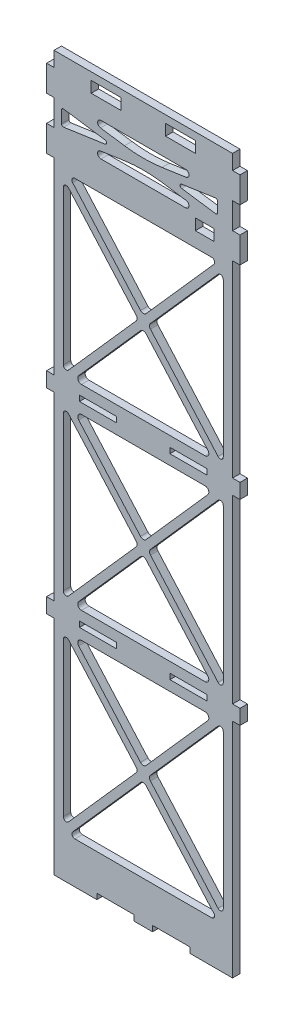
from build123d import *

# Parameters (mm, degrees)
SKETCH_1_W      = 5
SKETCH_1_H      = 3
SKETCH_1_W_2    = 8
EXTRUDE_1_DEPTH = 2


with BuildPart() as part:
    # 草图1 → 凸台-拉伸1 (new body)
    with BuildSketch(Plane.XY):
        Polygon((2263.240360422, 1874.892720575), (2311.240360422, 1874.892720575), (2311.240360422, 1870.892720575), (2313.240360422, 1870.892720575), (2313.240360422, 1863.892720575), (2311.240360422, 1863.892720575), (2311.240360422, 1856.892720575), (2313.240360422, 1856.892720575), (2313.240360422, 1849.892720575), (2311.240360422, 1849.892720575), (2311.240360422, 1799.292720575), (2313.240360422, 1799.292720575), (2313.240360422, 1795.292720575), (2311.240360422, 1795.292720575), (2311.240360422, 1746.692720575), (2313.240360422, 1746.692720575), (2313.240360422, 1742.692720575), (2311.240360422, 1742.692720575), (2311.240360422, 1682.892720575), (2299.740360422, 1682.892720575), (2299.740360422, 1684.392720575), (2289.740360422, 1684.392720575), (2289.740360422, 1683.642720575), (2289.740360422, 1682.892720575), (2284.740360422, 1682.892720575), (2284.740360422, 1683.642720575), (2284.740360422, 1684.392720575), (2274.740360422, 1684.392720575), (2274.740360422, 1682.892720575), (2263.240360422, 1682.892720575), (2263.240360422, 1742.692720575), (2261.240360422, 1742.692720575), (2261.240360422, 1746.692720575), (2263.240360422, 1746.692720575), (2263.240360422, 1795.292720575), (2261.240360422, 1795.292720575), (2261.240360422, 1799.292720575), (2263.240360422, 1799.292720575), (2263.240360422, 1849.892720575), (2261.240360422, 1849.892720575), (2261.240360422, 1856.892720575), (2263.240360422, 1856.892720575), (2263.240360422, 1863.892720575), (2261.240360422, 1863.892720575), (2261.240360422, 1870.892720575), (2263.240360422, 1870.892720575), align=None)
        with Locations((2303.740360422, 1853.392720575)):
            Rectangle(SKETCH_1_W, SKETCH_1_H, mode=Mode.SUBTRACT)
        with BuildLine():
            Line((2268.851583431, 1847.892720575), (2305.629137413, 1847.892720575))
            ThreePointArc((2305.629137413, 1847.892720575), (2306.358551508, 1847.421285756), (2306.228287599, 1846.562608271))
            Line((2306.228287599, 1846.562608271), (2290.985049082, 1829.334203808))
            Line((2290.985049082, 1829.334203808), (2290.139510608, 1828.378548695))
            Line((2290.139510608, 1828.378548695), (2287.989298154, 1825.948308573))
            ThreePointArc((2287.989298154, 1825.948308573), (2287.240360422, 1825.610948953), (2286.49142269, 1825.948308573))
            Line((2286.49142269, 1825.948308573), (2284.341210236, 1828.378548695))
            Line((2284.341210236, 1828.378548695), (2283.495671762, 1829.334203808))
            Line((2283.495671762, 1829.334203808), (2268.252433245, 1846.562608271))
            ThreePointArc((2268.252433245, 1846.562608271), (2268.122169336, 1847.421285756), (2268.851583431, 1847.892720575))
        make_face(mode=Mode.SUBTRACT)
        with BuildLine():
            Line((2305.341210236, 1842.541776176), (2289.161871666, 1824.255360955))
            ThreePointArc((2289.161871666, 1824.255360955), (2288.910809399, 1823.592720575), (2289.161871666, 1822.930080195))
            Line((2289.161871666, 1822.930080195), (2305.341210236, 1804.643664974))
            Line((2305.341210236, 1804.643664974), (2307.341210236, 1802.383199858))
            ThreePointArc((2307.341210236, 1802.383199858), (2308.223803407, 1802.165207841), (2308.740360422, 1802.913312162))
            Line((2308.740360422, 1802.913312162), (2308.740360422, 1823.592720575))
            Line((2308.740360422, 1823.592720575), (2308.740360422, 1844.272128988))
            ThreePointArc((2308.740360422, 1844.272128988), (2308.223803407, 1845.020233309), (2307.341210236, 1844.802241293))
            Line((2307.341210236, 1844.802241293), (2305.341210236, 1842.541776176))
        make_face(mode=Mode.SUBTRACT)
        with BuildLine():
            Line((2286.49142269, 1821.237132577), (2269.873805823, 1802.455360955))
            ThreePointArc((2269.873805823, 1802.455360955), (2269.710975936, 1801.382014098), (2270.622743555, 1800.792720575))
            Line((2270.622743555, 1800.792720575), (2287.240360422, 1800.792720575))
            Line((2287.240360422, 1800.792720575), (2303.857977289, 1800.792720575))
            ThreePointArc((2303.857977289, 1800.792720575), (2304.769744908, 1801.382014098), (2304.606915021, 1802.455360955))
            Line((2304.606915021, 1802.455360955), (2287.989298154, 1821.237132577))
            ThreePointArc((2287.989298154, 1821.237132577), (2287.240360422, 1821.574492197), (2286.49142269, 1821.237132577))
        make_face(mode=Mode.SUBTRACT)
        with BuildLine():
            Line((2285.318849178, 1822.930080195), (2269.139510608, 1804.643664974))
            Line((2269.139510608, 1804.643664974), (2267.139510608, 1802.383199858))
            ThreePointArc((2267.139510608, 1802.383199858), (2266.256917437, 1802.165207841), (2265.740360422, 1802.913312162))
            Line((2265.740360422, 1802.913312162), (2265.740360422, 1823.592720575))
            Line((2265.740360422, 1823.592720575), (2265.740360422, 1844.272128988))
            ThreePointArc((2265.740360422, 1844.272128988), (2266.256917437, 1845.020233309), (2267.139510608, 1844.802241293))
            Line((2267.139510608, 1844.802241293), (2269.139510608, 1842.541776176))
            Line((2269.139510608, 1842.541776176), (2285.318849178, 1824.255360955))
            ThreePointArc((2285.318849178, 1824.255360955), (2285.569911446, 1823.592720575), (2285.318849178, 1822.930080195))
        make_face(mode=Mode.SUBTRACT)
        Polygon((2294.398544686, 1796.542720575), (2294.398544686, 1797.292720575), (2294.398544686, 1798.042720575), (2304.398544686, 1798.042720575), (2304.398544686, 1796.542720575), align=None, mode=Mode.SUBTRACT)
        Polygon((2280.082176158, 1796.542720575), (2280.082176158, 1797.292720575), (2280.082176158, 1798.042720575), (2270.082176158, 1798.042720575), (2270.082176158, 1796.542720575), align=None, mode=Mode.SUBTRACT)
        with BuildLine():
            Line((2305.341210236, 1789.941776176), (2289.161871666, 1771.655360955))
            ThreePointArc((2289.161871666, 1771.655360955), (2288.910809398, 1770.992720575), (2289.161871666, 1770.330080195))
            Line((2289.161871666, 1770.330080195), (2305.341210236, 1752.043664974))
            Line((2305.341210236, 1752.043664974), (2307.341210236, 1749.783199858))
            ThreePointArc((2307.341210236, 1749.783199858), (2308.223803407, 1749.565207841), (2308.740360422, 1750.313312162))
            Line((2308.740360422, 1750.313312162), (2308.740360422, 1770.992720575))
            Line((2308.740360422, 1770.992720575), (2308.740360422, 1791.672128988))
            ThreePointArc((2308.740360422, 1791.672128988), (2308.223803407, 1792.420233309), (2307.341210236, 1792.202241292))
            Line((2307.341210236, 1792.202241292), (2305.341210236, 1789.941776176))
        make_face(mode=Mode.SUBTRACT)
        with BuildLine():
            Line((2286.49142269, 1768.637132577), (2269.873805823, 1749.855360955))
            ThreePointArc((2269.873805823, 1749.855360955), (2269.710975936, 1748.782014098), (2270.622743555, 1748.192720575))
            Line((2270.622743555, 1748.192720575), (2287.240360422, 1748.192720575))
            Line((2287.240360422, 1748.192720575), (2303.857977289, 1748.192720575))
            ThreePointArc((2303.857977289, 1748.192720575), (2304.769744908, 1748.782014098), (2304.606915021, 1749.855360955))
            Line((2304.606915021, 1749.855360955), (2287.989298154, 1768.637132577))
            ThreePointArc((2287.989298154, 1768.637132577), (2287.240360422, 1768.974492197), (2286.49142269, 1768.637132577))
        make_face(mode=Mode.SUBTRACT)
        with BuildLine():
            Line((2304.606915021, 1792.130080195), (2290.985049082, 1776.734203808))
            Line((2290.985049082, 1776.734203808), (2290.139510608, 1775.778548695))
            Line((2290.139510608, 1775.778548695), (2287.989298154, 1773.348308573))
            ThreePointArc((2287.989298154, 1773.348308573), (2287.240360422, 1773.010948953), (2286.49142269, 1773.348308573))
            Line((2286.49142269, 1773.348308573), (2284.341210236, 1775.778548695))
            Line((2284.341210236, 1775.778548695), (2283.495671762, 1776.734203808))
            Line((2283.495671762, 1776.734203808), (2269.873805823, 1792.130080195))
            ThreePointArc((2269.873805823, 1792.130080195), (2269.710975936, 1793.203427052), (2270.622743555, 1793.792720575))
            Line((2270.622743555, 1793.792720575), (2287.240360422, 1793.792720575))
            Line((2287.240360422, 1793.792720575), (2303.857977289, 1793.792720575))
            ThreePointArc((2303.857977289, 1793.792720575), (2304.769744908, 1793.203427052), (2304.606915021, 1792.130080195))
        make_face(mode=Mode.SUBTRACT)
        with BuildLine():
            Line((2285.318849178, 1770.330080195), (2269.139510608, 1752.043664974))
            Line((2269.139510608, 1752.043664974), (2267.139510608, 1749.783199858))
            ThreePointArc((2267.139510608, 1749.783199858), (2266.256917437, 1749.565207841), (2265.740360422, 1750.313312162))
            Line((2265.740360422, 1750.313312162), (2265.740360422, 1770.992720575))
            Line((2265.740360422, 1770.992720575), (2265.740360422, 1791.672128988))
            ThreePointArc((2265.740360422, 1791.672128988), (2266.256917437, 1792.420233309), (2267.139510608, 1792.202241293))
            Line((2267.139510608, 1792.202241293), (2269.139510608, 1789.941776176))
            Line((2269.139510608, 1789.941776176), (2285.318849178, 1771.655360955))
            ThreePointArc((2285.318849178, 1771.655360955), (2285.569911446, 1770.992720575), (2285.318849178, 1770.330080195))
        make_face(mode=Mode.SUBTRACT)
        Polygon((2294.398544686, 1745.442720575), (2294.398544686, 1744.692720575), (2294.398544686, 1743.942720575), (2304.398544686, 1743.942720575), (2304.398544686, 1745.442720575), align=None, mode=Mode.SUBTRACT)
        Polygon((2280.082176158, 1745.442720575), (2280.082176158, 1744.692720575), (2280.082176158, 1743.942720575), (2270.082176158, 1743.942720575), (2270.082176158, 1745.442720575), align=None, mode=Mode.SUBTRACT)
        with BuildLine():
            Line((2287.240360422, 1694.092720575), (2305.629137413, 1694.092720575))
            ThreePointArc((2305.629137413, 1694.092720575), (2306.358551508, 1694.564155394), (2306.228287599, 1695.422832879))
            Line((2306.228287599, 1695.422832879), (2287.989298154, 1716.037132577))
            ThreePointArc((2287.989298154, 1716.037132577), (2287.240360422, 1716.374492197), (2286.49142269, 1716.037132577))
            Line((2286.49142269, 1716.037132577), (2268.252433245, 1695.422832879))
            ThreePointArc((2268.252433245, 1695.422832879), (2268.122169336, 1694.564155394), (2268.851583431, 1694.092720575))
            Line((2268.851583431, 1694.092720575), (2287.240360422, 1694.092720575))
        make_face(mode=Mode.SUBTRACT)
        with BuildLine():
            Line((2305.341210236, 1737.341776176), (2289.161871666, 1719.055360955))
            ThreePointArc((2289.161871666, 1719.055360955), (2288.910809398, 1718.392720575), (2289.161871666, 1717.730080195))
            Line((2289.161871666, 1717.730080195), (2305.341210236, 1699.443664974))
            Line((2305.341210236, 1699.443664974), (2307.341210236, 1697.183199858))
            ThreePointArc((2307.341210236, 1697.183199858), (2308.223803407, 1696.965207841), (2308.740360422, 1697.713312162))
            Line((2308.740360422, 1697.713312162), (2308.740360422, 1718.392720575))
            Line((2308.740360422, 1718.392720575), (2308.740360422, 1739.072128988))
            ThreePointArc((2308.740360422, 1739.072128988), (2308.223803407, 1739.820233309), (2307.341210236, 1739.602241293))
            Line((2307.341210236, 1739.602241293), (2305.341210236, 1737.341776176))
        make_face(mode=Mode.SUBTRACT)
        with BuildLine():
            Line((2304.606915021, 1739.530080195), (2290.985049082, 1724.134203808))
            Line((2290.985049082, 1724.134203808), (2290.139510608, 1723.178548695))
            Line((2290.139510608, 1723.178548695), (2287.989298154, 1720.748308573))
            ThreePointArc((2287.989298154, 1720.748308573), (2287.240360422, 1720.410948953), (2286.49142269, 1720.748308573))
            Line((2286.49142269, 1720.748308573), (2284.341210236, 1723.178548695))
            Line((2284.341210236, 1723.178548695), (2283.495671762, 1724.134203808))
            Line((2283.495671762, 1724.134203808), (2269.873805823, 1739.530080195))
            ThreePointArc((2269.873805823, 1739.530080195), (2269.710975936, 1740.603427052), (2270.622743555, 1741.192720575))
            Line((2270.622743555, 1741.192720575), (2287.240360422, 1741.192720575))
            Line((2287.240360422, 1741.192720575), (2303.857977289, 1741.192720575))
            ThreePointArc((2303.857977289, 1741.192720575), (2304.769744908, 1740.603427052), (2304.606915021, 1739.530080195))
        make_face(mode=Mode.SUBTRACT)
        with BuildLine():
            Line((2285.318849178, 1717.730080195), (2269.139510608, 1699.443664974))
            Line((2269.139510608, 1699.443664974), (2267.139510608, 1697.183199858))
            ThreePointArc((2267.139510608, 1697.183199858), (2266.256917437, 1696.965207841), (2265.740360422, 1697.713312162))
            Line((2265.740360422, 1697.713312162), (2265.740360422, 1718.392720575))
            Line((2265.740360422, 1718.392720575), (2265.740360422, 1739.072128988))
            ThreePointArc((2265.740360422, 1739.072128988), (2266.256917437, 1739.820233309), (2267.139510608, 1739.602241293))
            Line((2267.139510608, 1739.602241293), (2269.139510608, 1737.341776176))
            Line((2269.139510608, 1737.341776176), (2285.318849178, 1719.055360955))
            ThreePointArc((2285.318849178, 1719.055360955), (2285.569911446, 1718.392720575), (2285.318849178, 1717.730080195))
        make_face(mode=Mode.SUBTRACT)
        with Locations((2297.240360422, 1871.392720575)):
            Rectangle(SKETCH_1_W_2, SKETCH_1_H, mode=Mode.SUBTRACT)
        with Locations((2277.240360422, 1871.392720575)):
            Rectangle(SKETCH_1_W_2, SKETCH_1_H, mode=Mode.SUBTRACT)
        with BuildLine():
            Line((2265.811557175, 1862.507177582), (2276.91867506, 1860.887389802))
            ThreePointArc((2276.91867506, 1860.887389802), (2277.34585767, 1860.393056029), (2276.91867506, 1859.898051348))
            Line((2276.91867506, 1859.898051348), (2265.812513879, 1858.278402143))
            ThreePointArc((2265.812513879, 1858.278402143), (2265.413310524, 1858.394964501), (2265.240360422, 1858.773168632))
            Line((2265.240360422, 1858.773168632), (2265.240360422, 1862.012272518))
            ThreePointArc((2265.240360422, 1862.012272518), (2265.412945072, 1862.390160317), (2265.811557175, 1862.507177582))
        make_face(mode=Mode.SUBTRACT)
        with BuildLine():
            Line((2292.291101717, 1858.64557792), (2298.744451714, 1857.704464521))
            ThreePointArc((2298.744451714, 1857.704464521), (2299.516682252, 1856.743218403), (2298.613820243, 1855.903471837))
            Line((2298.613820243, 1855.903471837), (2275.866900645, 1855.903471837))
            ThreePointArc((2275.866900645, 1855.903471837), (2274.964073235, 1856.742743123), (2275.735326146, 1857.704326489))
            Line((2275.735326146, 1857.704326489), (2282.189619202, 1858.645577702))
            ThreePointArc((2282.189619202, 1858.645577702), (2287.240360452, 1859.011923474), (2292.291101717, 1858.64557792))
        make_face(mode=Mode.SUBTRACT)
        with BuildLine():
            Line((2275.736269174, 1863.080976629), (2282.189619202, 1862.139863448))
            ThreePointArc((2282.189619202, 1862.139863448), (2287.240360452, 1861.773517676), (2292.291101717, 1862.13986323))
            Line((2292.291101717, 1862.13986323), (2298.744451714, 1863.080976629))
            ThreePointArc((2298.744451714, 1863.080976629), (2299.516682252, 1864.042222747), (2298.613820243, 1864.881969313))
            Line((2298.613820243, 1864.881969313), (2275.866900645, 1864.881969313))
            ThreePointArc((2275.866900645, 1864.881969313), (2274.964038636, 1864.042222747), (2275.736269174, 1863.080976629))
        make_face(mode=Mode.SUBTRACT)
        with BuildLine():
            Line((2297.562709648, 1859.897954086), (2306.668207008, 1858.570068854))
            ThreePointArc((2306.668207008, 1858.570068854), (2307.067410364, 1858.686631212), (2307.240360466, 1859.064835343))
            Line((2307.240360466, 1859.064835343), (2307.240360466, 1861.720605807))
            ThreePointArc((2307.240360466, 1861.720605807), (2307.067410364, 1862.098809938), (2306.668207008, 1862.215372296))
            Line((2306.668207008, 1862.215372296), (2297.562709648, 1860.887487064))
            ThreePointArc((2297.562709648, 1860.887487064), (2297.134863105, 1860.392720575), (2297.562709648, 1859.897954086))
        make_face(mode=Mode.SUBTRACT)
    extrude(amount=EXTRUDE_1_DEPTH)


solid = part.part
